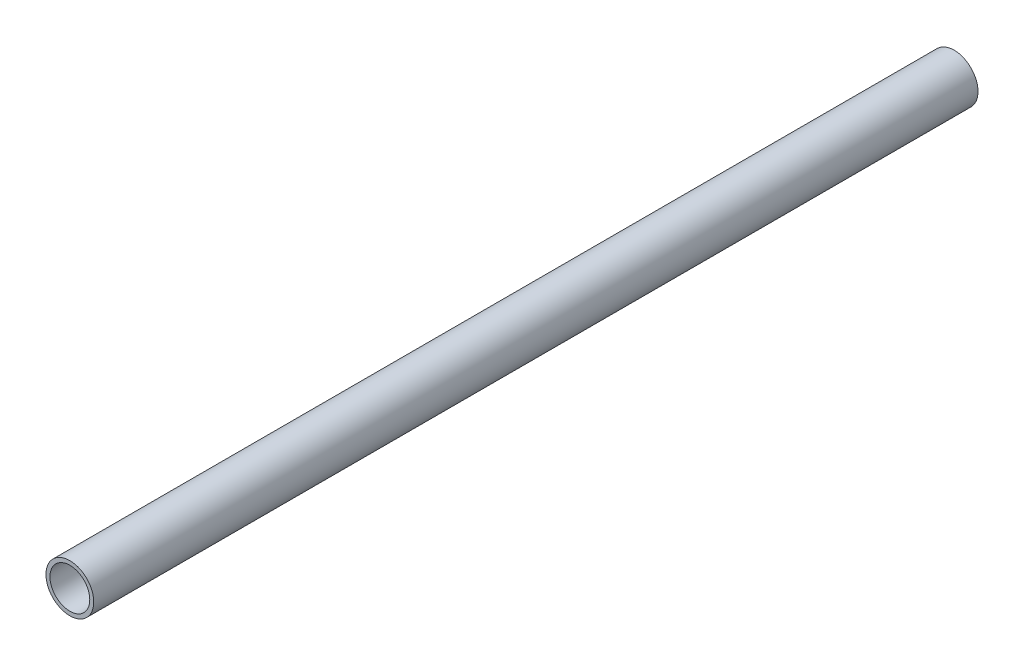
from build123d import *

# Parameters (mm, degrees)
SKETCH1_R           = 9
SKETCH1_R_2         = 7.5
BOSS_EXTRUDE1_DEPTH = 333


with BuildPart() as part:
    # Sketch1 → Boss-Extrude1 (new body)
    with BuildSketch(Plane.XY):
        Circle(SKETCH1_R)
        Circle(SKETCH1_R_2, mode=Mode.SUBTRACT)
    extrude(amount=BOSS_EXTRUDE1_DEPTH)


solid = part.part
